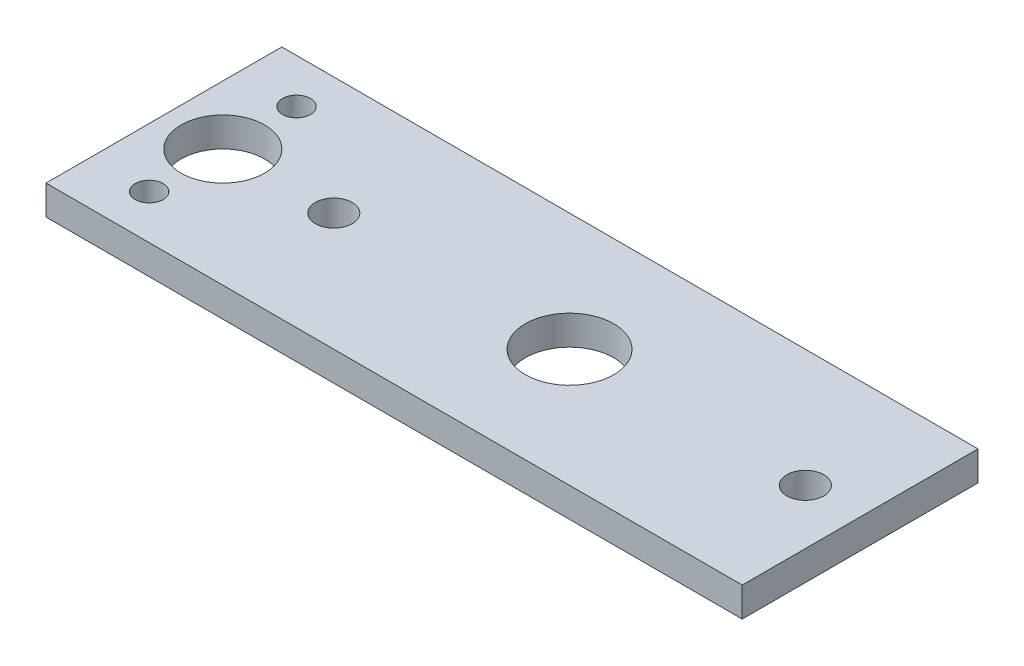
from build123d import *

# Parameters (mm, degrees)
SKETCH1_W           = 75
SKETCH1_H           = 25.4
SKETCH1_R           = 4.7625
SKETCH1_R_2         = 1.5
SKETCH1_R_3         = 4.5
BOSS_EXTRUDE1_DEPTH = 3.175
SKETCH2_R           = 1.984375
CUT_EXTRUDE1_DEPTH  = 3.175


with BuildPart() as part:
    # Sketch1 → Boss-Extrude1 (new body)
    with BuildSketch(Plane(origin=(0, 0, 0), x_dir=(1, 0, 0), z_dir=(0, 1, 0))):
        with Locations((37.5, 12.7)):
            Rectangle(SKETCH1_W, SKETCH1_H)
        with Locations(Location((43.7, 12.7, 0), (0, 0, 270))):
            Circle(SKETCH1_R, mode=Mode.SUBTRACT)
        with Locations(Location((6.35, 20.6375, 0), (0, 0, 270))):
            Circle(SKETCH1_R_2, mode=Mode.SUBTRACT)
        with Locations(Location((6.35, 4.7625, 0), (0, 0, 270))):
            Circle(SKETCH1_R_2, mode=Mode.SUBTRACT)
        with Locations(Location((6.35, 12.7, 0), (0, 0, 270))):
            Circle(SKETCH1_R_3, mode=Mode.SUBTRACT)
    extrude(amount=BOSS_EXTRUDE1_DEPTH)

    # Sketch2 → Cut-Extrude1 (cut)
    with BuildSketch(Plane(origin=(0, 0, 0), x_dir=(-1, 0, 0), z_dir=(0, -1, 0))):
        with Locations(Location((-18.3, 12.7, 0), (0, 0, 90))):
            Circle(SKETCH2_R)
        with Locations(Location((-69.1, 12.7, 0), (0, 0, 90))):
            Circle(SKETCH2_R)
    extrude(amount=-CUT_EXTRUDE1_DEPTH, mode=Mode.SUBTRACT)


solid = part.part
